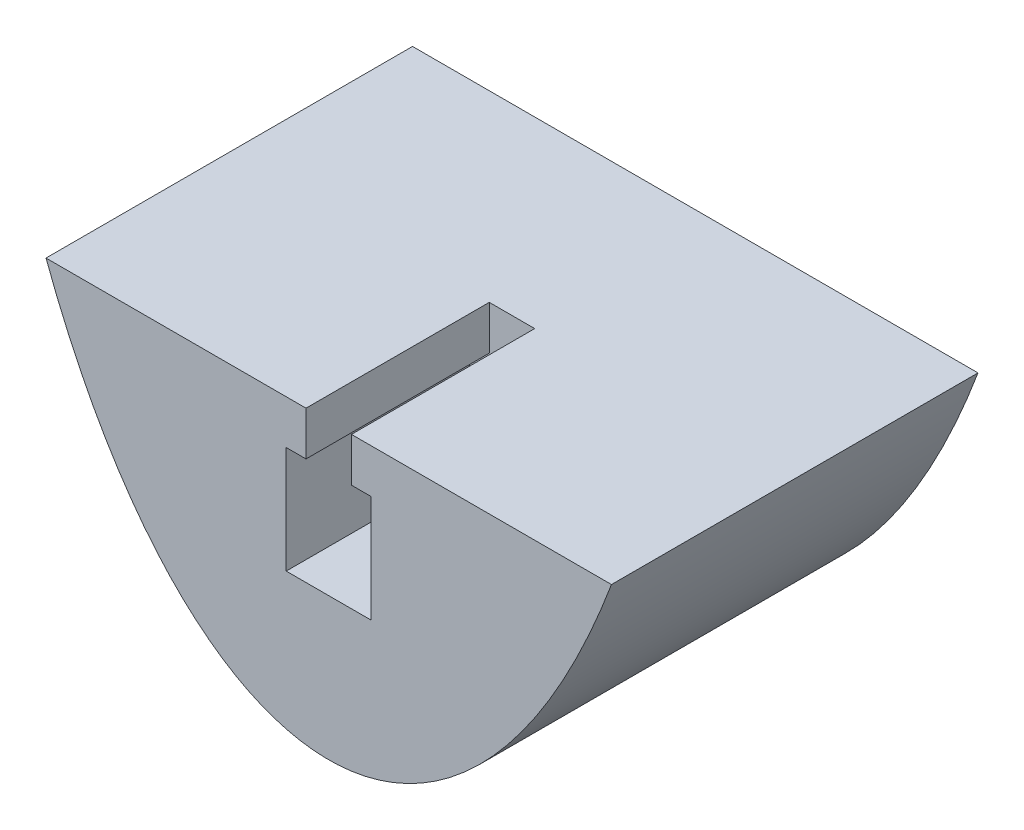
from build123d import *

# Parameters (mm, degrees)
SALIENTE_EXTRUIR6_DEPTH = 25
CROQUIS10_W             = 3.1
CROQUIS10_H             = 12.5
CORTAR_EXTRUIR1_DEPTH   = 3
CROQUIS14_W             = 5.8
CROQUIS14_H             = 12.5
CORTAR_EXTRUIR3_DEPTH   = 7.3


with BuildPart() as part:
    # Croquis9 → Saliente-Extruir6 (new body)
    with BuildSketch(Plane.XY):
        with BuildLine():
            Line((5.43844596, -64.945905041), (44.007906752, -64.945905041))
            add(Edge.make_bspline(
                [(5.43844596, -64.945905041), (24.723176356, -116.374476469), (44.007906752, -64.945905041)],
                knots=[5.402163981, 5.402163981, 5.402163981, 7.164206633, 7.164206633, 7.164206633], degree=2, weights=[1, 0.636363636, 1]))
        make_face()
    extrude(amount=SALIENTE_EXTRUIR6_DEPTH)

    # Croquis10 → Cortar-Extruir1 (cut)
    with BuildSketch(Plane(origin=(0, -64.945905041, 0), x_dir=(1, 0, 0), z_dir=(0, 1, 0))):
        with Locations((24.722906752, -18.75)):
            Rectangle(CROQUIS10_W, CROQUIS10_H)
    extrude(amount=-CORTAR_EXTRUIR1_DEPTH, mode=Mode.SUBTRACT)

    # Croquis14 → Cortar-Extruir3 (cut)
    with BuildSketch(Plane(origin=(0, -67.945905041, 0), x_dir=(1, 0, 0), z_dir=(0, 1, 0))):
        with Locations((24.722906752, -18.75)):
            Rectangle(CROQUIS14_W, CROQUIS14_H)
    extrude(amount=-CORTAR_EXTRUIR3_DEPTH, mode=Mode.SUBTRACT)


solid = part.part
